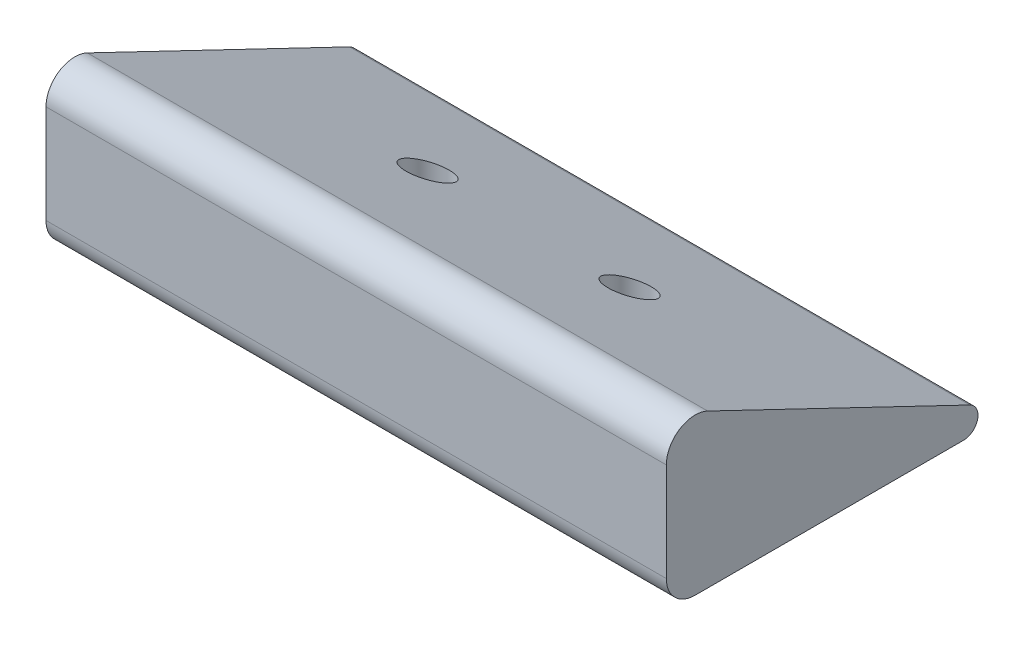
from build123d import *

# Parameters (mm, degrees)
BOSS_EXTRUDE1_DEPTH = 43
SKETCH2_R           = 1.5
CUT_EXTRUDE1_DEPTH  = 50.150879706


with BuildPart() as part:
    # Sketch1 → Boss-Extrude1 (new body)
    with BuildSketch(Plane(origin=(0, 0, 0), x_dir=(0, 0, -1), z_dir=(1, 0, 0))):
        with BuildLine():
            Line((2, 0), (20.605762563, 0))
            ThreePointArc((20.605762563, 0), (21.580832575, 0.778102566), (21.03849363, 1.901523057))
            Line((21.03849363, 1.901523057), (2.865462135, 10.624578175))
            ThreePointArc((2.865462135, 10.624578175), (0.934853125, 10.514299657), (0, 8.82153206))
            Line((0, 8.82153206), (0, 2))
            ThreePointArc((0, 2), (0.585786438, 0.585786438), (2, 0))
        make_face()
    extrude(amount=BOSS_EXTRUDE1_DEPTH)

    # Sketch2 → Cut-Extrude1 (cut, through all)
    with BuildSketch(Plane(origin=(0, 10, 0), x_dir=(1, 0, 0), z_dir=(0, 1, 0))):
        with Locations(Location((14.5, 11.951977883, 0), (0, 0, 270))):
            Circle(SKETCH2_R)
        with Locations(Location((28.5, 11.951977883, 0), (0, 0, 270))):
            Circle(SKETCH2_R)
    extrude(amount=-CUT_EXTRUDE1_DEPTH, mode=Mode.SUBTRACT)


solid = part.part
